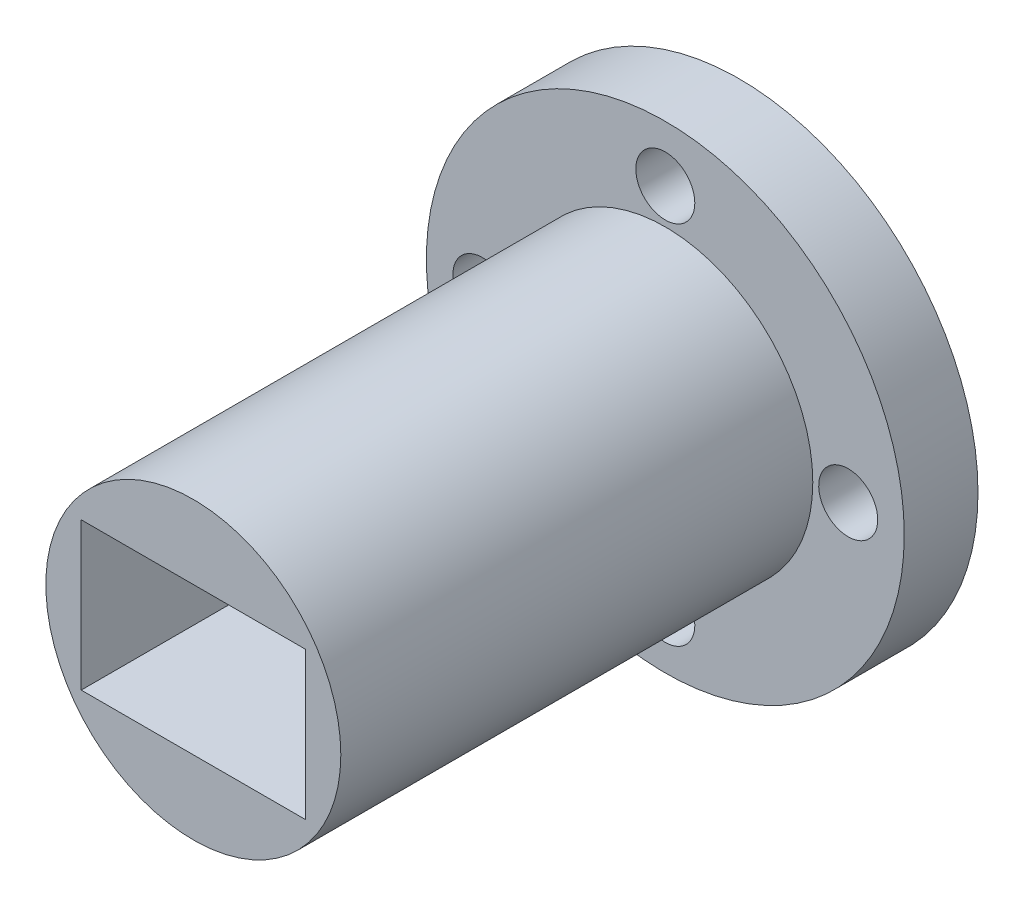
from build123d import *

# Parameters (mm, degrees)
SKETCH1_R           = 10.287
BOSS_EXTRUDE1_DEPTH = 3.175
SKETCH3_R           = 4.064
CUT_EXTRUDE1_DEPTH  = 2.38125
FILLET1_R           = 1.000000032
CUT_EXTRUDE2_REACH  = 16.89
SKETCH4_R           = 1.27
CIRPATTERN1_COUNT   = 4
SKETCH5_R           = 6.35
BOSS_EXTRUDE2_DEPTH = 20.32
SKETCH6_W           = 9.652
SKETCH6_H           = 6.35
CUT_EXTRUDE3_DEPTH  = 19.05


with BuildPart() as part:
    # Sketch1 → Boss-Extrude1 (new body)
    with BuildSketch(Plane.XY):
        Circle(SKETCH1_R)
    extrude(amount=BOSS_EXTRUDE1_DEPTH)

    # Sketch3 → Cut-Extrude1 (cut)
    with BuildSketch(Plane(origin=(0, 0, 0), x_dir=(-1, 0, 0), z_dir=(0, 0, -1))):
        Circle(SKETCH3_R)
    extrude(amount=-CUT_EXTRUDE1_DEPTH, mode=Mode.SUBTRACT)

    # Fillet1
    fillet1_edges = [part.edges().sort_by_distance(p)[0] for p in [
        (4.064, 0, 0),
    ]]
    fillet(fillet1_edges, radius=FILLET1_R)

    # Sketch4 → Cut-Extrude2 (cut, up to next)
    with BuildSketch(Plane(origin=(0, 0, 0), x_dir=(-1, 0, 0), z_dir=(0, 0, -1)), mode=Mode.PRIVATE) as cut_extrude2_sk1:
        with Locations((0, 7.874)):
            Circle(SKETCH4_R)
    cut_extrude2_tool1 = extrude(cut_extrude2_sk1.sketch, amount=-CUT_EXTRUDE2_REACH, mode=Mode.PRIVATE) & part.part
    cut_extrude2 = cut_extrude2_tool1.solids().sort_by_distance((0, 7.874, 0))[0]
    add(cut_extrude2, mode=Mode.SUBTRACT)

    # CirPattern1: Cut-Extrude2 ×4 about axis
    cirpattern1_axis = Axis((0, 0, 0), (0, 0, 1))
    for i in range(1, CIRPATTERN1_COUNT):
        add(cut_extrude2.rotate(cirpattern1_axis, i * 360 / CIRPATTERN1_COUNT), mode=Mode.SUBTRACT)

    # Sketch5 → Boss-Extrude2 (add)
    with BuildSketch(Plane.XY.offset(3.175)):
        Circle(SKETCH5_R)
    extrude(amount=BOSS_EXTRUDE2_DEPTH)

    # Sketch6 → Cut-Extrude3 (cut)
    with BuildSketch(Plane.XY.offset(23.495)):
        Rectangle(SKETCH6_W, SKETCH6_H)
    extrude(amount=-CUT_EXTRUDE3_DEPTH, mode=Mode.SUBTRACT)


solid = part.part
